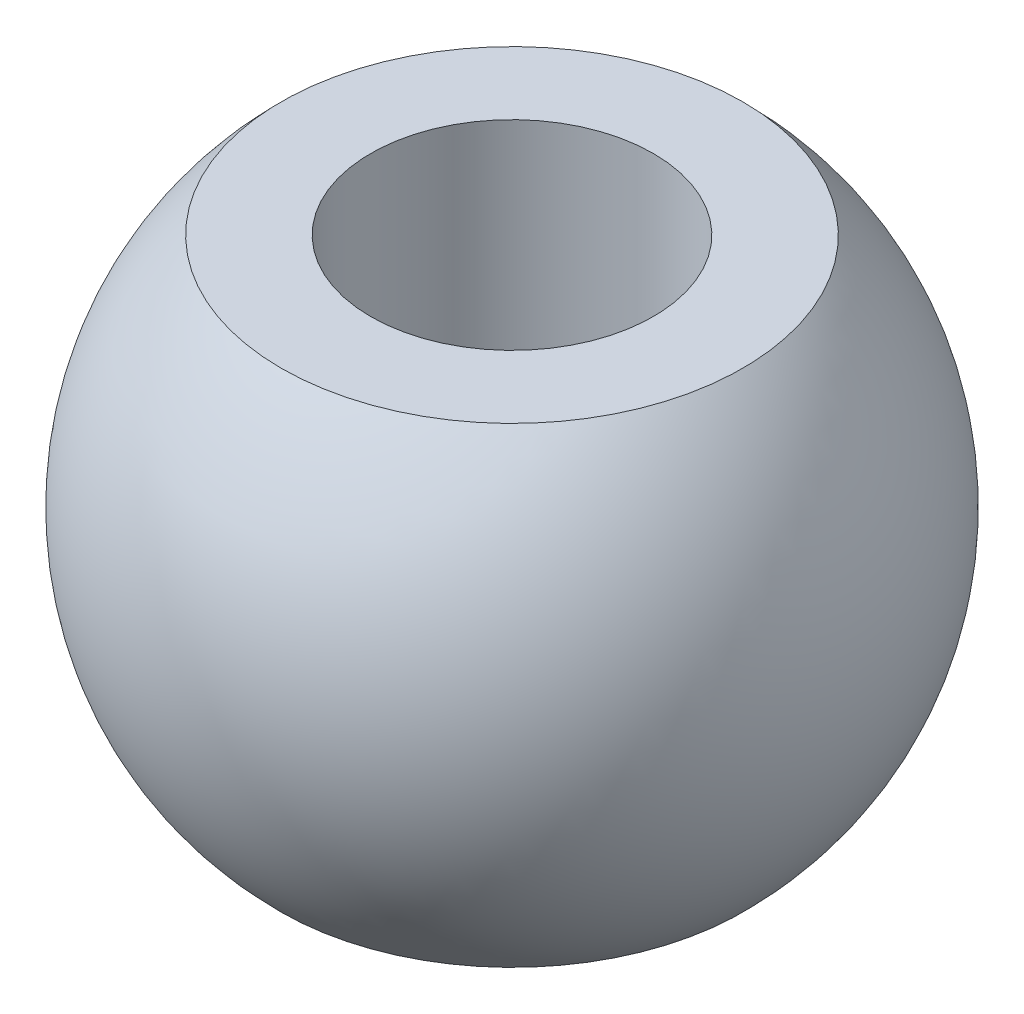
from build123d import *


with BuildPart() as part:
    # Sweep1: sweep along a path in Sketch2
    with BuildLine(Plane(origin=(0, 0, 0), x_dir=(1, 0, 0), z_dir=(0, 1, 0))) as sweep1_path:
        CenterArc((0, 0), 3.5, 0, 360)
    # Sketch3 → Sweep1 (sweep)
    with BuildSketch(Plane(origin=(0, 0, 0), x_dir=(0, 0, -1), z_dir=(1, 0, 0))):
        with BuildLine():
            Line((1.5, 2.5), (2.449489743, 2.5))
            ThreePointArc((2.449489743, 2.5), (3.5, 0), (2.449489743, -2.5))
            Line((2.449489743, -2.5), (1.5, -2.5))
            Line((1.5, -2.5), (1.5, 2.5))
        make_face()
    sweep(path=sweep1_path.line)


solid = part.part
